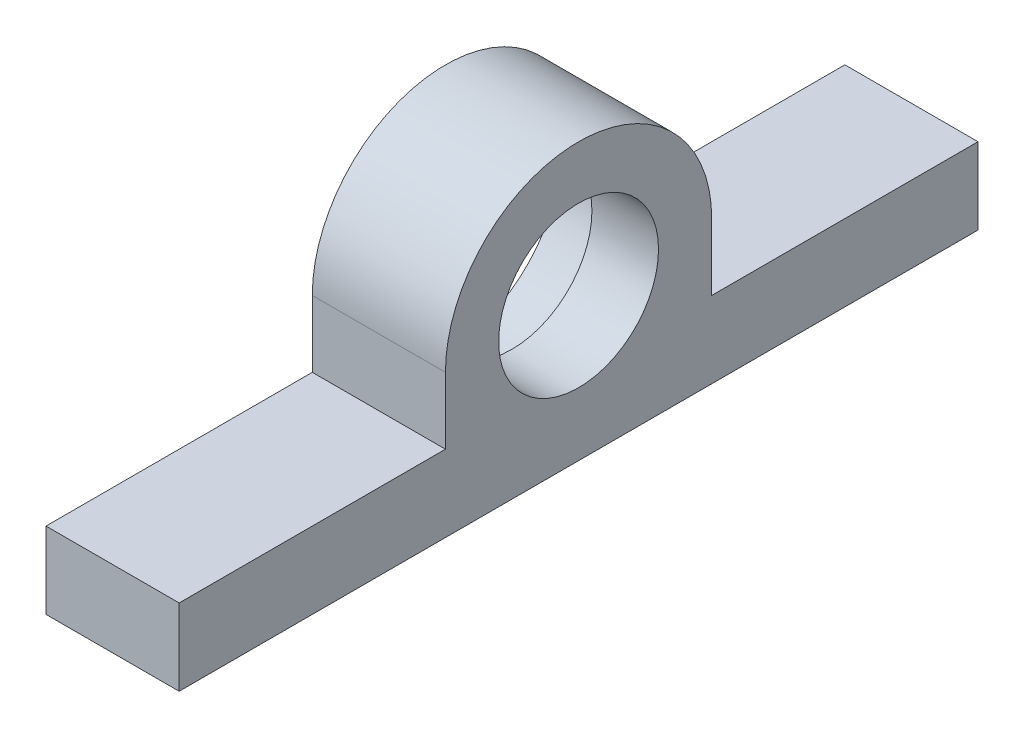
from build123d import *

# Parameters (mm, degrees)
BOSS_EXTRUDE1_DEPTH = 12.7
SKETCH2_R           = 7.62500004
CUT_EXTRUDE1_DEPTH  = 82.621397317
SKETCH3_R           = 2
CUT_EXTRUDE2_DEPTH  = 7
SKETCH4_R           = 11
CUT_EXTRUDE3_DEPTH  = 6.35


with BuildPart() as part:
    # Sketch1 → Boss-Extrude1 (new body)
    with BuildSketch(Plane(origin=(0, 0, 0), x_dir=(0, 0, -1), z_dir=(1, 0, 0))):
        with BuildLine():
            Line((0, 0), (76.2, 0))
            Line((76.2, 0), (76.2, 7.3))
            Line((76.2, 7.3), (50.8, 7.3))
            Line((50.8, 7.3), (50.8, 13.65))
            ThreePointArc((50.8, 13.65), (38.1, 26.35), (25.4, 13.65))
            Line((25.4, 13.65), (25.4, 7.3))
            Line((25.4, 7.3), (0, 7.3))
            Line((0, 7.3), (0, 0))
        make_face()
    extrude(amount=BOSS_EXTRUDE1_DEPTH)

    # Sketch2 → Cut-Extrude1 (cut, through all)
    with BuildSketch(Plane(origin=(12.7, 0, 0), x_dir=(0, 0, -1), z_dir=(1, 0, 0))):
        with Locations((38.1, 13.65)):
            Circle(SKETCH2_R)
    extrude(amount=-CUT_EXTRUDE1_DEPTH, mode=Mode.SUBTRACT)

    # Sketch3 → Cut-Extrude2 (cut)
    with BuildSketch(Plane.XZ):
        with Locations(Location((6.35, -12.7, 0), (0, 0, 270))):
            Circle(SKETCH3_R)
        with Locations(Location((6.35, -63.5, 0), (0, 0, 270))):
            Circle(SKETCH3_R)
    extrude(amount=-CUT_EXTRUDE2_DEPTH, mode=Mode.SUBTRACT)

    # Sketch4 → Cut-Extrude3 (cut)
    with BuildSketch(Plane.ZY):
        with Locations((-38.1, 13.65)):
            Circle(SKETCH4_R)
    extrude(amount=-CUT_EXTRUDE3_DEPTH, mode=Mode.SUBTRACT)


solid = part.part
